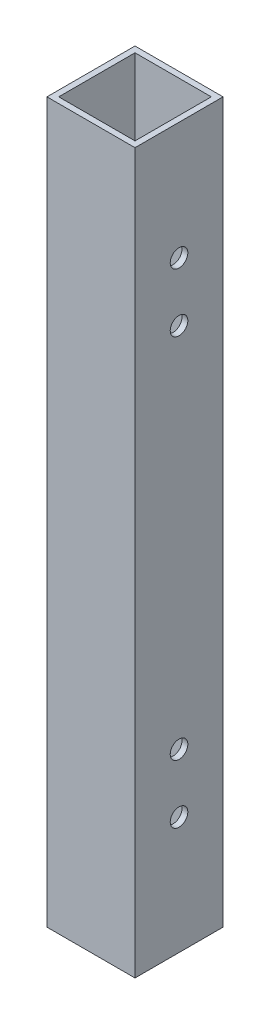
from build123d import *

# Parameters (mm, degrees)
BOSS_EXTRUDE1_DEPTH = 245
SKETCH2_W           = 26
SKETCH2_H           = 26
CUT_EXTRUDE1_DEPTH  = 245
SKETCH4_R           = 3
CUT_EXTRUDE3_DEPTH  = 30


with BuildPart() as part:
    # Sketch1 → Boss-Extrude1 (new body)
    with BuildSketch(Plane(origin=(0, 0, 0), x_dir=(1, 0, 0), z_dir=(0, 1, 0))):
        Polygon((-15, 0), (-15, 15), (15, 15), (15, -15), (-15, -15), align=None)
    extrude(amount=BOSS_EXTRUDE1_DEPTH)

    # Sketch2 → Cut-Extrude1 (cut)
    with BuildSketch(Plane(origin=(0, 245, 0), x_dir=(1, 0, 0), z_dir=(0, 1, 0))):
        Rectangle(SKETCH2_W, SKETCH2_H)
    extrude(amount=-CUT_EXTRUDE1_DEPTH, mode=Mode.SUBTRACT)

    # Sketch4 → Cut-Extrude3 (cut)
    with BuildSketch(Plane.ZY.offset(15)):
        with Locations((0, 205)):
            Circle(SKETCH4_R)
        with Locations((0, 185)):
            Circle(SKETCH4_R)
        with Locations((0, 60)):
            Circle(SKETCH4_R)
        with Locations((0, 40)):
            Circle(SKETCH4_R)
    extrude(amount=-CUT_EXTRUDE3_DEPTH, mode=Mode.SUBTRACT)


solid = part.part
